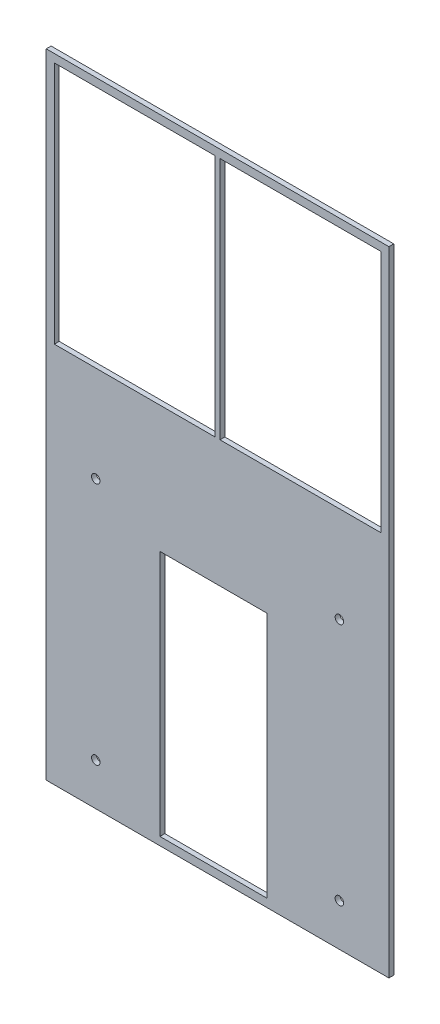
from build123d import *

# Parameters (mm, degrees)
SKETCH1_W           = 211
SKETCH1_H           = 390
SKETCH1_W_2         = 99
SKETCH1_H_2         = 150
SKETCH1_W_3         = 66
SKETCH1_H_3         = 152
BOSS_EXTRUDE1_DEPTH = 3
SKETCH2_R           = 2.6
CUT_EXTRUDE1_DEPTH  = 348.276906805


with BuildPart() as part:
    # Sketch1 → Boss-Extrude1 (new body)
    with BuildSketch(Plane.XY):
        with Locations((51, -115)):
            Rectangle(SKETCH1_W, SKETCH1_H)
        Rectangle(SKETCH1_W_2, SKETCH1_H_2, mode=Mode.SUBTRACT)
        with Locations((102, 0)):
            Rectangle(SKETCH1_W_2, SKETCH1_H_2, mode=Mode.SUBTRACT)
        with Locations((48.5, -229)):
            Rectangle(SKETCH1_W_3, SKETCH1_H_3, mode=Mode.SUBTRACT)
    extrude(amount=BOSS_EXTRUDE1_DEPTH)

    # Sketch2 → Cut-Extrude1 (cut, through all)
    with BuildSketch(Plane.XY.offset(3)):
        with Locations((-24, -134)):
            Circle(SKETCH2_R)
        with Locations((126, -134)):
            Circle(SKETCH2_R)
        with Locations((126, -284)):
            Circle(SKETCH2_R)
        with Locations((-24, -284)):
            Circle(SKETCH2_R)
    extrude(amount=-CUT_EXTRUDE1_DEPTH, mode=Mode.SUBTRACT)


solid = part.part
